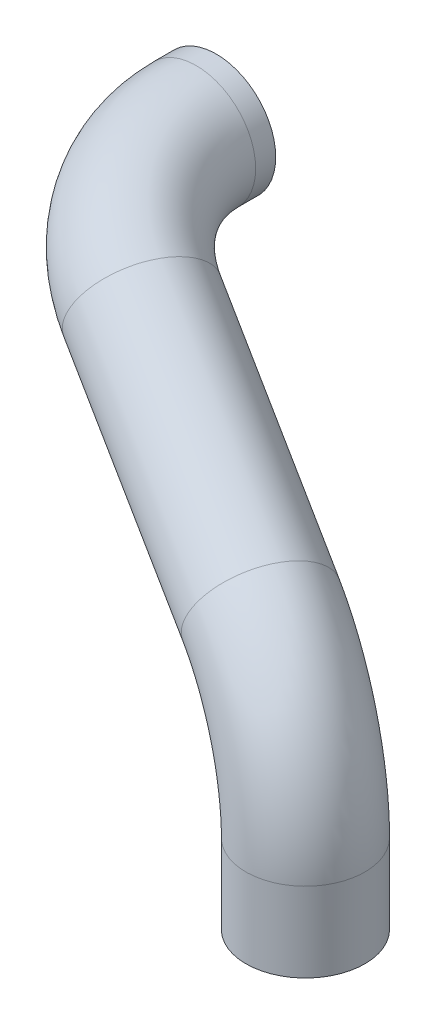
from build123d import *

# Parameters (mm, degrees)
SWEEP_1_PROFILE_R   = 10
SWEEP_1_PROFILE_R_2 = 7.5


with BuildPart() as part:
    # 扫描-薄件1: sweep along a curve in space
    with BuildLine() as sweep_1_path:
        Line((0, 0, 0), (0, 13.370069625, 0))
        ThreePointArc((0, 13.370069625, 0), (-3.799479767, 27.216391611, -1.753606046), (-13.925963802, 36.427367909, -6.427367909))
        Line((-51.074036198, 53.572632091, -23.572632091), (-13.925963802, 36.427367909, -6.427367909))
        ThreePointArc((-65, 60, -46.629930375), (-61.200520233, 58.246393954, -32.783608389), (-51.074036198, 53.572632091, -23.572632091))
        Line((-65, 60, -46.629930375), (-65, 60, -50))
    # 扫描-薄件1 profile (on start of the path) → 扫描-薄件1 (sweep)
    with BuildSketch(Plane(origin=(0, 0, 0), x_dir=(1, 0, 0), z_dir=(0, 1, 0))):
        Circle(SWEEP_1_PROFILE_R)
        Circle(SWEEP_1_PROFILE_R_2, mode=Mode.SUBTRACT)
    sweep(path=sweep_1_path.line)


solid = part.part
